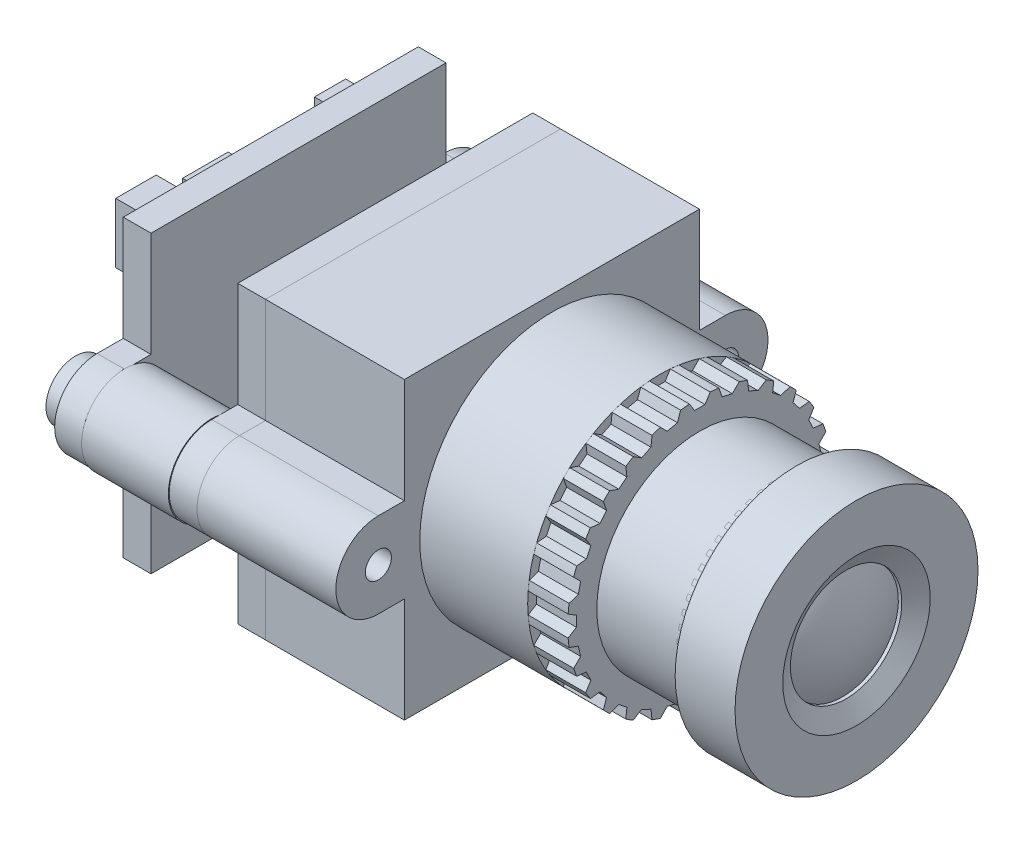
from build123d import *

# Parameters (mm, degrees)
SKETCH1_R             = 7
BOSS_EXTRUDE1_DEPTH   = 3.45
SKETCH2_R             = 5.935
BOSS_EXTRUDE2_DEPTH   = 5.58
SKETCH3_R             = 7.61
BOSS_EXTRUDE3_DEPTH   = 2.3
SKETCH4_W             = 0.6
SKETCH4_H             = 4.25
CUT_EXTRUDE1_DEPTH    = 2.3
BOSS_EXTRUDE4_DEPTH   = 6.22
SKETCH7_R             = 0.75
BOSS_EXTRUDE5_DEPTH   = 8
SKETCH8_R             = 0.75
BOSS_EXTRUDE6_DEPTH   = 1.6
SKETCH9_R             = 2.5
SKETCH9_R_2           = 1
BOSS_EXTRUDE7_DEPTH   = 5
BOSS_EXTRUDE7_2_DEPTH = 5
SKETCH10_R            = 0.75
BOSS_EXTRUDE8_DEPTH   = 1.6
SKETCH11_W            = 7
SKETCH11_H            = 3.2
BOSS_EXTRUDE9_DEPTH   = 4.8
SKETCH12_W            = 6.3
SKETCH12_H            = 2.5
CUT_EXTRUDE2_DEPTH    = 4.4
SKETCH13_W            = 4.8
SKETCH13_H            = 0.35
CUT_EXTRUDE3_DEPTH    = 1.5
SKETCH14_W            = 2.3306508
SKETCH14_H            = 3.458981743
SKETCH14_W_2          = 2.293656343
SKETCH14_H_2          = 3.939909685
SKETCH14_W_3          = 1.627756114
SKETCH14_H_3          = 1.923711771
SKETCH14_W_4          = 4.2728598
SKETCH14_H_4          = 1.960706228
SKETCH14_W_5          = 1.794231171
SKETCH14_H_5          = 2.793081515
SKETCH14_W_6          = 2.626606457
SKETCH14_H_6          = 1.331800458
BOSS_EXTRUDE10_DEPTH  = 2.2
SKETCH15_R            = 1.7
BOSS_EXTRUDE11_DEPTH  = 1.25
SKETCH16_R            = 5.935
BOSS_EXTRUDE12_DEPTH  = 1


with BuildPart() as part:
    # Sketch1 → Boss-Extrude1 (new body)
    with BuildSketch(Plane(origin=(0, 0, 0), x_dir=(0, 0, -1), z_dir=(1, 0, 0))):
        Circle(SKETCH1_R)
    extrude(amount=-BOSS_EXTRUDE1_DEPTH)

    # Sketch2 → Boss-Extrude2 (add)
    with BuildSketch(Plane.ZY.offset(3.45)):
        with Locations(Location((0, 0, 0), (0, 0, 180))):
            Circle(SKETCH2_R)
    extrude(amount=BOSS_EXTRUDE2_DEPTH)

    # Sketch3 → Boss-Extrude3 (add)
    with BuildSketch(Plane.ZY.offset(9.03)):
        Circle(SKETCH3_R)
    extrude(amount=BOSS_EXTRUDE3_DEPTH)

    # Sketch4 → Cut-Revolve7 (revolve, cut)
    with BuildSketch(Plane.XY, mode=Mode.PRIVATE) as cut_revolve7_sk:
        with BuildLine():
            Line((-0.6, 2.803361203), (-0.6, 3.210769515))
            Line((-0.6, 3.210769515), (-0.8, 3.210769515))
            add(Edge.make_bspline(
                [(-0.6, 2.803361203), (-0.692820323, 3.008825328), (-0.8, 3.210769515)],
                knots=[0.866025404, 0.866025404, 0.866025404, 1, 1, 1], degree=2))
        make_face()
        with Locations((0.3, 2.125)):
            Rectangle(SKETCH4_W, SKETCH4_H)
        with BuildLine():
            Line((0, 0), (0, 4.25))
            Line((0, 4.25), (-0.6, 3.210769515))
            Line((-0.6, 3.210769515), (-0.6, 2.803361203))
            add(Edge.make_bspline(
                [(0, 0), (0, 1.475220219), (-0.6, 2.803361203)],
                knots=[0, 0, 0, 0.866025404, 0.866025404, 0.866025404], degree=2))
        make_face()
    revolve(cut_revolve7_sk.sketch.rotate(Axis((-11.8965, 0, 0), (1, 0, 0)), 90), axis=Axis((-11.8965, 0, 0), (1, 0, 0)), mode=Mode.SUBTRACT)

    # Sketch5 → Cut-Extrude1 (cut)
    with BuildSketch(Plane(origin=(-9.03, 0, 0), x_dir=(0, 0, -1), z_dir=(1, 0, 0))):
        with BuildLine():
            ThreePointArc((3.832157886, 6.574698923), (3.301855255, 6.856373085), (2.750995245, 7.09535941))
            Line((2.750995245, 7.09535941), (2.814622725, 6.536053773))
            Line((2.814622725, 6.536053773), (3.355204045, 6.275723529))
            Line((3.355204045, 6.275723529), (3.832157886, 6.574698923))
        make_face()
        with BuildLine():
            ThreePointArc((2.273069542, 7.262592847), (1.693384307, 7.419201412), (1.103156048, 7.529617967))
            Line((1.103156048, 7.529617967), (1.289645467, 6.998493736))
            Line((1.289645467, 6.998493736), (1.874602214, 6.864981175))
            Line((1.874602214, 6.864981175), (2.273069542, 7.262592847))
        make_face()
        with BuildLine():
            ThreePointArc((0.6, 7.586310038), (0.300233748, 7.604075203), (0, 7.61))
            Line((0, 7.61), (0, 7.11))
            Line((0, 7.11), (0.3, 7.11))
            Line((0.3, 7.11), (0.6, 7.586310038))
        make_face()
        with BuildLine():
            Line((-1.289645467, 6.998493736), (-1.103156048, 7.529617967))
            ThreePointArc((-1.103156048, 7.529617967), (-1.693384307, 7.419201412), (-2.273069542, 7.262592847))
            Line((-2.273069542, 7.262592847), (-1.874602214, 6.864981175))
            Line((-1.874602214, 6.864981175), (-1.289645467, 6.998493736))
        make_face()
        with BuildLine():
            Line((0, 7.11), (0, 7.61))
            ThreePointArc((0, 7.61), (-0.300233748, 7.604075203), (-0.6, 7.586310038))
            Line((-0.6, 7.586310038), (-0.3, 7.11))
            Line((-0.3, 7.11), (0, 7.11))
        make_face()
        with BuildLine():
            Line((-2.814622725, 6.536053773), (-2.750995245, 7.09535941))
            ThreePointArc((-2.750995245, 7.09535941), (-3.301855255, 6.856373085), (-3.832157886, 6.574698923))
            Line((-3.832157886, 6.574698923), (-3.355204045, 6.275723529))
            Line((-3.355204045, 6.275723529), (-2.814622725, 6.536053773))
        make_face()
        with BuildLine():
            Line((-4.198463046, 5.745868781), (-4.260888053, 6.305309905))
            ThreePointArc((-4.260888053, 6.305309905), (-4.744757392, 5.949737582), (-5.199085832, 5.557122143))
            Line((-5.199085832, 5.557122143), (-4.667561936, 5.3717749))
            Line((-4.667561936, 5.3717749), (-4.198463046, 5.745868781))
        make_face()
        with BuildLine():
            Line((-5.3717749, 4.667561936), (-5.557122143, 5.199085832))
            ThreePointArc((-5.557122143, 5.199085832), (-5.949737582, 4.744757392), (-6.305309905, 4.260888053))
            Line((-6.305309905, 4.260888053), (-5.745868781, 4.198463046))
            Line((-5.745868781, 4.198463046), (-5.3717749, 4.667561936))
        make_face()
        with BuildLine():
            Line((-6.275723529, 3.355204045), (-6.574698923, 3.832157886))
            ThreePointArc((-6.574698923, 3.832157886), (-6.856373085, 3.301855255), (-7.09535941, 2.750995245))
            Line((-7.09535941, 2.750995245), (-6.536053773, 2.814622725))
            Line((-6.536053773, 2.814622725), (-6.275723529, 3.355204045))
        make_face()
        with BuildLine():
            Line((-6.864981175, 1.874602214), (-7.262592847, 2.273069542))
            ThreePointArc((-7.262592847, 2.273069542), (-7.419201412, 1.693384307), (-7.529617967, 1.103156048))
            Line((-7.529617967, 1.103156048), (-6.998493736, 1.289645467))
            Line((-6.998493736, 1.289645467), (-6.864981175, 1.874602214))
        make_face()
        with BuildLine():
            Line((-7.11, 0.3), (-7.586310038, 0.6))
            ThreePointArc((-7.586310038, 0.6), (-7.61, 0), (-7.586310038, -0.6))
            Line((-7.586310038, -0.6), (-7.11, -0.3))
            Line((-7.11, -0.3), (-7.11, 0.3))
        make_face()
        with BuildLine():
            ThreePointArc((-7.529617967, -1.103156048), (-7.419201412, -1.693384307), (-7.262592847, -2.273069542))
            Line((-7.262592847, -2.273069542), (-6.864981175, -1.874602214))
            Line((-6.864981175, -1.874602214), (-6.998493736, -1.289645467))
            Line((-6.998493736, -1.289645467), (-7.529617967, -1.103156048))
        make_face()
        with BuildLine():
            ThreePointArc((-7.09535941, -2.750995245), (-6.856373085, -3.301855255), (-6.574698923, -3.832157886))
            Line((-6.574698923, -3.832157886), (-6.275723529, -3.355204045))
            Line((-6.275723529, -3.355204045), (-6.536053773, -2.814622725))
            Line((-6.536053773, -2.814622725), (-7.09535941, -2.750995245))
        make_face()
        with BuildLine():
            ThreePointArc((-6.305309905, -4.260888053), (-5.949737582, -4.744757392), (-5.557122143, -5.199085832))
            Line((-5.557122143, -5.199085832), (-5.3717749, -4.667561936))
            Line((-5.3717749, -4.667561936), (-5.745868781, -4.198463046))
            Line((-5.745868781, -4.198463046), (-6.305309905, -4.260888053))
        make_face()
        with BuildLine():
            ThreePointArc((-3.832157886, -6.574698923), (-3.301855255, -6.856373085), (-2.750995245, -7.09535941))
            Line((-2.750995245, -7.09535941), (-2.814622725, -6.536053773))
            Line((-2.814622725, -6.536053773), (-3.355204045, -6.275723529))
            Line((-3.355204045, -6.275723529), (-3.832157886, -6.574698923))
        make_face()
        with BuildLine():
            ThreePointArc((-5.199085832, -5.557122143), (-4.744757392, -5.949737582), (-4.260888053, -6.305309905))
            Line((-4.260888053, -6.305309905), (-4.198463046, -5.745868781))
            Line((-4.198463046, -5.745868781), (-4.667561936, -5.3717749))
            Line((-4.667561936, -5.3717749), (-5.199085832, -5.557122143))
        make_face()
        with BuildLine():
            ThreePointArc((-2.273069542, -7.262592847), (-1.693384307, -7.419201412), (-1.103156048, -7.529617967))
            Line((-1.103156048, -7.529617967), (-1.289645467, -6.998493736))
            Line((-1.289645467, -6.998493736), (-1.874602214, -6.864981175))
            Line((-1.874602214, -6.864981175), (-2.273069542, -7.262592847))
        make_face()
        with BuildLine():
            Line((0, -7.61), (0, -7.11))
            Line((0, -7.11), (-0.3, -7.11))
            Line((-0.3, -7.11), (-0.6, -7.586310038))
            ThreePointArc((-0.6, -7.586310038), (-0.300233748, -7.604075203), (0, -7.61))
        make_face()
        with BuildLine():
            Line((0.3, -7.11), (0, -7.11))
            Line((0, -7.11), (0, -7.61))
            ThreePointArc((0, -7.61), (0.300233748, -7.604075203), (0.6, -7.586310038))
            Line((0.6, -7.586310038), (0.3, -7.11))
        make_face()
        with BuildLine():
            Line((1.289645467, -6.998493736), (1.103156048, -7.529617967))
            ThreePointArc((1.103156048, -7.529617967), (1.693384307, -7.419201412), (2.273069542, -7.262592847))
            Line((2.273069542, -7.262592847), (1.874602214, -6.864981175))
            Line((1.874602214, -6.864981175), (1.289645467, -6.998493736))
        make_face()
        with BuildLine():
            Line((2.814622725, -6.536053773), (2.750995245, -7.09535941))
            ThreePointArc((2.750995245, -7.09535941), (3.301855255, -6.856373085), (3.832157886, -6.574698923))
            Line((3.832157886, -6.574698923), (3.355204045, -6.275723529))
            Line((3.355204045, -6.275723529), (2.814622725, -6.536053773))
        make_face()
        with BuildLine():
            Line((4.198463046, -5.745868781), (4.260888053, -6.305309905))
            ThreePointArc((4.260888053, -6.305309905), (4.744757392, -5.949737582), (5.199085832, -5.557122143))
            Line((5.199085832, -5.557122143), (4.667561936, -5.3717749))
            Line((4.667561936, -5.3717749), (4.198463046, -5.745868781))
        make_face()
        with BuildLine():
            Line((5.3717749, -4.667561936), (5.557122143, -5.199085832))
            ThreePointArc((5.557122143, -5.199085832), (5.949737582, -4.744757392), (6.305309905, -4.260888053))
            Line((6.305309905, -4.260888053), (5.745868781, -4.198463046))
            Line((5.745868781, -4.198463046), (5.3717749, -4.667561936))
        make_face()
        with BuildLine():
            Line((6.275723529, -3.355204045), (6.574698923, -3.832157886))
            ThreePointArc((6.574698923, -3.832157886), (6.856373085, -3.301855255), (7.09535941, -2.750995245))
            Line((7.09535941, -2.750995245), (6.536053773, -2.814622725))
            Line((6.536053773, -2.814622725), (6.275723529, -3.355204045))
        make_face()
        with BuildLine():
            Line((6.864981175, -1.874602214), (7.262592847, -2.273069542))
            ThreePointArc((7.262592847, -2.273069542), (7.419201412, -1.693384307), (7.529617967, -1.103156048))
            Line((7.529617967, -1.103156048), (6.998493736, -1.289645467))
            Line((6.998493736, -1.289645467), (6.864981175, -1.874602214))
        make_face()
        with BuildLine():
            ThreePointArc((7.61, 0), (7.604075203, 0.300233748), (7.586310038, 0.6))
            Line((7.586310038, 0.6), (7.11, 0.3))
            Line((7.11, 0.3), (7.11, -0.3))
            Line((7.11, -0.3), (7.586310038, -0.6))
            ThreePointArc((7.586310038, -0.6), (7.604075203, -0.300233748), (7.61, 0))
        make_face()
        with BuildLine():
            ThreePointArc((7.529617967, 1.103156048), (7.419201412, 1.693384307), (7.262592847, 2.273069542))
            Line((7.262592847, 2.273069542), (6.864981175, 1.874602214))
            Line((6.864981175, 1.874602214), (6.998493736, 1.289645467))
            Line((6.998493736, 1.289645467), (7.529617967, 1.103156048))
        make_face()
        with BuildLine():
            ThreePointArc((7.09535941, 2.750995245), (6.856373085, 3.301855255), (6.574698923, 3.832157886))
            Line((6.574698923, 3.832157886), (6.275723529, 3.355204045))
            Line((6.275723529, 3.355204045), (6.536053773, 2.814622725))
            Line((6.536053773, 2.814622725), (7.09535941, 2.750995245))
        make_face()
        with BuildLine():
            ThreePointArc((6.305309905, 4.260888053), (5.949737582, 4.744757392), (5.557122143, 5.199085832))
            Line((5.557122143, 5.199085832), (5.3717749, 4.667561936))
            Line((5.3717749, 4.667561936), (5.745868781, 4.198463046))
            Line((5.745868781, 4.198463046), (6.305309905, 4.260888053))
        make_face()
        with BuildLine():
            ThreePointArc((5.199085832, 5.557122143), (4.744757392, 5.949737582), (4.260888053, 6.305309905))
            Line((4.260888053, 6.305309905), (4.198463046, 5.745868781))
            Line((4.198463046, 5.745868781), (4.667561936, 5.3717749))
            Line((4.667561936, 5.3717749), (5.199085832, 5.557122143))
        make_face()
    extrude(amount=-CUT_EXTRUDE1_DEPTH, mode=Mode.SUBTRACT)

    # Sketch6 → Boss-Extrude4 (add)
    with BuildSketch(Plane.ZY.offset(11.33)):
        with BuildLine():
            Line((-1.25, -7.511705865), (-1.25, -8.5))
            Line((-1.25, -8.5), (1.25, -8.5))
            Line((1.25, -8.5), (1.25, -7.511705865))
            ThreePointArc((1.25, -7.511705865), (0, 7.615), (-1.25, -7.511705865))
        make_face()
    extrude(amount=BOSS_EXTRUDE4_DEPTH)

    # Sketch7 → Boss-Extrude5 (add)
    with BuildSketch(Plane.ZY.offset(17.55)):
        with BuildLine():
            Line((-8.5, 8.5), (-8.5, 2.45))
            Line((-8.5, 2.45), (-10, 2.45))
            ThreePointArc((-10, 2.45), (-12.45, 0), (-10, -2.45))
            Line((-10, -2.45), (-8.5, -2.45))
            Line((-8.5, -2.45), (-8.5, -8.5))
            Line((-8.5, -8.5), (8.5, -8.5))
            Line((8.5, -8.5), (8.5, -2.45))
            Line((8.5, -2.45), (10, -2.45))
            ThreePointArc((10, -2.45), (12.45, 0), (10, 2.45))
            Line((10, 2.45), (8.5, 2.45))
            Line((8.5, 2.45), (8.5, 8.5))
            Line((8.5, 8.5), (-8.5, 8.5))
        make_face()
        with Locations((-10, 0)):
            Circle(SKETCH7_R, mode=Mode.SUBTRACT)
        with Locations((10, 0)):
            Circle(SKETCH7_R, mode=Mode.SUBTRACT)
    extrude(amount=BOSS_EXTRUDE5_DEPTH)


with BuildPart() as body_2:
    # Sketch8 → Boss-Extrude6 (new body)
    with BuildSketch(Plane.ZY.offset(25.55)):
        with BuildLine():
            Line((-10, -2.45), (-8.5, -2.45))
            Line((-8.5, -2.45), (-8.5, -8.5))
            Line((-8.5, -8.5), (8.5, -8.5))
            Line((8.5, -8.5), (8.5, -2.45))
            Line((8.5, -2.45), (10, -2.45))
            ThreePointArc((10, -2.45), (12.45, 0), (10, 2.45))
            Line((10, 2.45), (8.5, 2.45))
            Line((8.5, 2.45), (8.5, 8.5))
            Line((8.5, 8.5), (-8.5, 8.5))
            Line((-8.5, 8.5), (-8.5, 2.45))
            Line((-8.5, 2.45), (-10, 2.45))
            ThreePointArc((-10, 2.45), (-12.45, 0), (-10, -2.45))
        make_face()
        with Locations((10, 0)):
            Circle(SKETCH8_R, mode=Mode.SUBTRACT)
        with Locations((-10, 0)):
            Circle(SKETCH8_R, mode=Mode.SUBTRACT)
    extrude(amount=BOSS_EXTRUDE6_DEPTH)


with BuildPart() as body_3:
    # Sketch9 → Boss-Extrude7 (new body)
    with BuildSketch(Plane.ZY.offset(27.15)):
        with Locations((-10, 0)):
            Circle(SKETCH9_R)
        with Locations((-10, 0)):
            Circle(SKETCH9_R_2, mode=Mode.SUBTRACT)
    extrude(amount=BOSS_EXTRUDE7_DEPTH)


with BuildPart() as body_4:
    # Sketch9 → Boss-Extrude7 2 (new body)
    with BuildSketch(Plane.ZY.offset(27.15)):
        with Locations(Location((10, 0, 0), (0, 0, 180))):
            Circle(SKETCH9_R)
        with Locations(Location((10, 0, 0), (0, 0, 180))):
            Circle(SKETCH9_R_2, mode=Mode.SUBTRACT)
    extrude(amount=BOSS_EXTRUDE7_2_DEPTH)


with BuildPart() as body_5:
    # Sketch10 → Boss-Extrude8 (new body)
    with BuildSketch(Plane.ZY.offset(32.15)):
        with BuildLine():
            Line((-10, -2.45), (-8.5, -2.45))
            Line((-8.5, -2.45), (-8.5, -8.5))
            Line((-8.5, -8.5), (8.5, -8.5))
            Line((8.5, -8.5), (8.5, -2.45))
            Line((8.5, -2.45), (10, -2.45))
            ThreePointArc((10, -2.45), (12.45, 0), (10, 2.45))
            Line((10, 2.45), (8.5, 2.45))
            Line((8.5, 2.45), (8.5, 8.5))
            Line((8.5, 8.5), (-8.5, 8.5))
            Line((-8.5, 8.5), (-8.5, 2.45))
            Line((-8.5, 2.45), (-10, 2.45))
            ThreePointArc((-10, 2.45), (-12.45, 0), (-10, -2.45))
        make_face()
        with Locations((10, 0)):
            Circle(SKETCH10_R, mode=Mode.SUBTRACT)
        with Locations((-10, 0)):
            Circle(SKETCH10_R, mode=Mode.SUBTRACT)
    extrude(amount=BOSS_EXTRUDE8_DEPTH)

    # Sketch14 → Boss-Extrude10 (add)
    with BuildSketch(Plane.ZY.offset(33.75)):
        with Locations((5.5676658, 5.724892243)):
            Rectangle(SKETCH14_W, SKETCH14_H)
        with Locations((4.772284972, -6.076339586)):
            Rectangle(SKETCH14_W_2, SKETCH14_H_2)
        with Locations((-1.738739486, -2.922562115)):
            Rectangle(SKETCH14_W_3, SKETCH14_H_3)
        with Locations((-1.267060157, 1.202319857)):
            Rectangle(SKETCH14_W_4, SKETCH14_H_4)
        with Locations((-5.613908872, 5.391942129)):
            Rectangle(SKETCH14_W_5, SKETCH14_H_5)
        with Locations((1.572264429, 5.863621457)):
            Rectangle(SKETCH14_W_6, SKETCH14_H_6)
    extrude(amount=BOSS_EXTRUDE10_DEPTH)

    # Sketch15 → Boss-Extrude11 (add)
    with BuildSketch(Plane.ZY.offset(33.75)):
        with Locations((-10, 0)):
            Circle(SKETCH15_R)
        with Locations((10, 0)):
            Circle(SKETCH15_R)
    extrude(amount=BOSS_EXTRUDE11_DEPTH)


with BuildPart() as body_6:
    # Sketch11 → Boss-Extrude9 (new body)
    with BuildSketch(Plane.ZY.offset(33.75)):
        with Locations((0, -6.3)):
            Rectangle(SKETCH11_W, SKETCH11_H)
    extrude(amount=BOSS_EXTRUDE9_DEPTH)

    # Sketch12 → Cut-Extrude2 (cut)
    with BuildSketch(Plane.ZY.offset(38.55)):
        with Locations((0, -6.3)):
            Rectangle(SKETCH12_W, SKETCH12_H)
    extrude(amount=-CUT_EXTRUDE2_DEPTH, mode=Mode.SUBTRACT)

    # Sketch13 → Cut-Extrude3 (cut)
    with BuildSketch(Plane.ZY.offset(38.55)):
        with Locations((0, -4.875)):
            Rectangle(SKETCH13_W, SKETCH13_H)
    extrude(amount=-CUT_EXTRUDE3_DEPTH, mode=Mode.SUBTRACT)


with BuildPart() as body_7:
    # Sketch16 → Boss-Extrude12 (new body)
    with BuildSketch(Plane.ZY.offset(3.45)):
        Circle(SKETCH16_R)
    extrude(amount=BOSS_EXTRUDE12_DEPTH)


solid = Compound([part.part, body_2.part, body_3.part, body_4.part, body_5.part, body_6.part, body_7.part])
